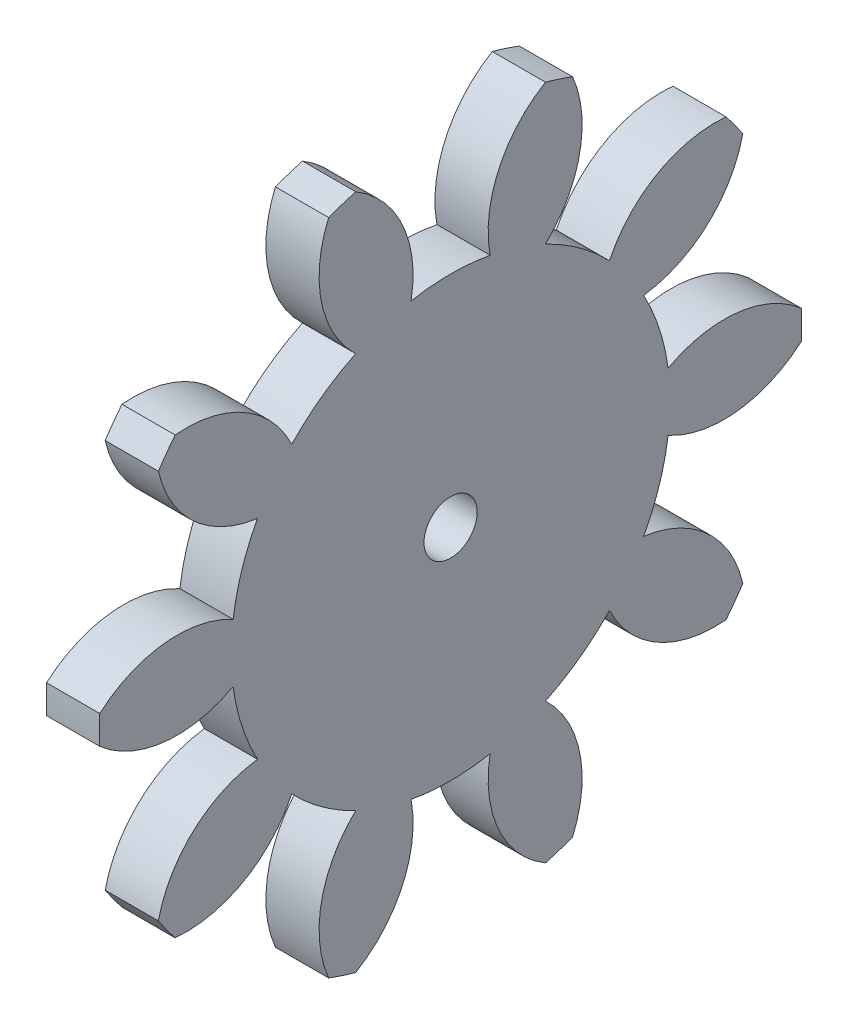
from build123d import *

# Parameters (mm, degrees)
BASPROSKE_W     = 5
BASPROSKE_H     = 33
TOOTHCUT_DEPTH  = 47.936126811
TEETHCUTS_COUNT = 10
TEETHCUTS_ANGLE = 324
BORSKE_R        = 2.5
BORE_DEPTH      = 50.0000508


with BuildPart() as part:
    # BasProSke → Base-Revolve (revolve)
    with BuildSketch(Plane(origin=(0, 0, 0), x_dir=(1, 0, 0), z_dir=(0, 1, 0)), mode=Mode.PRIVATE) as base_revolve_sk:
        with Locations((2.5, 16.5)):
            Rectangle(BASPROSKE_W, BASPROSKE_H)
    revolve(base_revolve_sk.sketch.rotate(Axis((-10, 0, 0), (1, 0, 0)), 180), axis=Axis((-10, 0, 0), (1, 0, 0)))

    # TooCutSke → ToothCut (cut, through all)
    with BuildSketch(Plane(origin=(0, 0, 0), x_dir=(0, 0, -1), z_dir=(1, 0, 0))):
        with BuildLine():
            ThreePointArc((3.715637309, 20.286532858), (0, 20.624), (-3.715637309, 20.286532858))
            ThreePointArc((-3.715637309, 20.286532858), (-4.514470182, 26.864678639), (-8.947046806, 31.790366443))
            ThreePointArc((-8.947046806, 31.790366443), (0, 33.0254), (8.947046806, 31.790366443))
            ThreePointArc((8.947046806, 31.790366443), (4.514470182, 26.864678639), (3.715637309, 20.286532858))
        make_face()
    toothcut = extrude(amount=TOOTHCUT_DEPTH, mode=Mode.SUBTRACT)

    # TeethCuts: ToothCut ×10 about axis
    teethcuts_axis = Axis((-10, 0, 0), (1, 0, 0))
    for i in range(1, TEETHCUTS_COUNT):
        add(toothcut.rotate(teethcuts_axis, i * TEETHCUTS_ANGLE / (TEETHCUTS_COUNT - 1)), mode=Mode.SUBTRACT)

    # BorSke → Bore (cut, symmetric)
    with BuildSketch(Plane(origin=(0, 0, 0), x_dir=(0, 0, -1), z_dir=(1, 0, 0))):
        with Locations(Location((0, 0, 0), (0, 0, 180))):
            Circle(BORSKE_R)
    extrude(amount=BORE_DEPTH, both=True, mode=Mode.SUBTRACT)


solid = part.part
